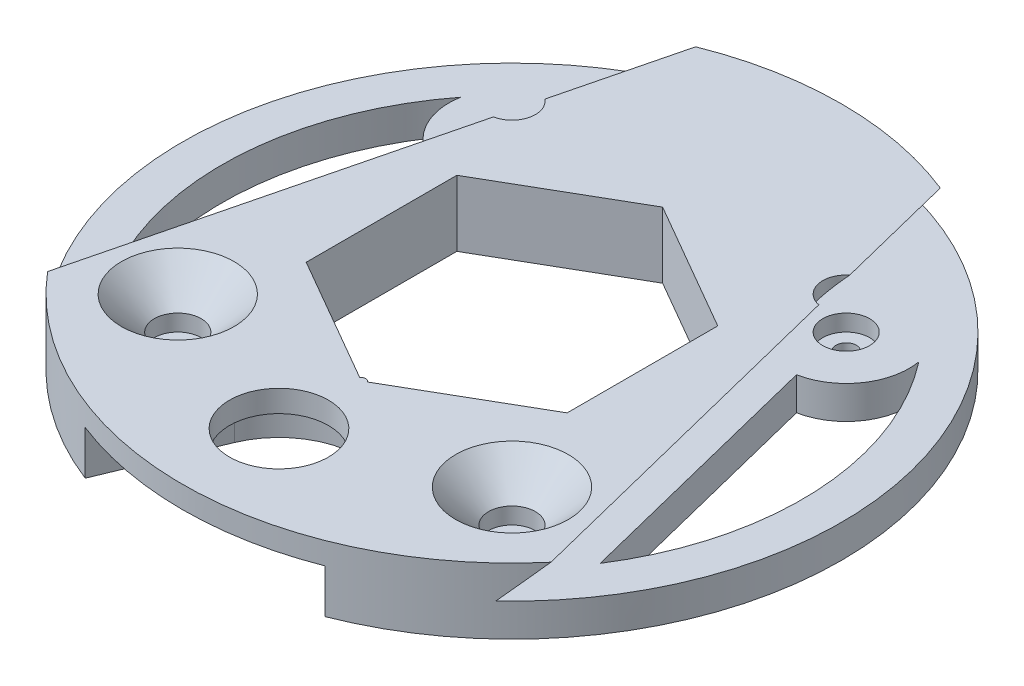
from build123d import *

# Parameters (mm, degrees)
SKETCH1_R               = 50
BOSS_EXTRUDE1_DEPTH     = 5
BOSS_EXTRUDE3_START     = 5
BOSS_EXTRUDE3_DEPTH     = 5
DRAFT2_ANGLE            = -45
CUT_EXTRUDE3_DEPTH      = 72.414284285
CUT_EXTRUDE3_DEPTH_BACK = 72.414284285
SKETCH3_R               = 7.5
CUT_EXTRUDE5_START      = -6.666666667
CUT_EXTRUDE5_DEPTH      = 6.666666667
SKETCH5_R               = 3.55
SKETCH5_R_2             = 1.55
CUT_EXTRUDE6_DEPTH      = 72.414284285
SKETCH5_3_R             = 3.55
SKETCH5_3_R_2           = 1.55
BOSS_EXTRUDE4_DEPTH     = 2.5
CUT_EXTRUDE8_DEPTH      = 72.414284285
CHAMFER1_SIZE           = 5
CUT_EXTRUDE9_DEPTH      = 71.887234394


with BuildPart() as part:
    # Sketch1 → Boss-Extrude1 (new body)
    with BuildSketch(Plane(origin=(0, 0, 0), x_dir=(1, 0, 0), z_dir=(0, 1, 0))):
        with Locations(Location((0, 0, 0), (0, 0, 270))):
            Circle(SKETCH1_R)
    extrude(amount=-BOSS_EXTRUDE1_DEPTH)

    # Sketch1<6> → Boss-Extrude3 (add)
    with BuildSketch(Plane(origin=(0, 0, 0), x_dir=(1, 0, 0), z_dir=(0, 1, 0)).offset(BOSS_EXTRUDE3_START)):
        with BuildLine():
            Line((-12.940952256, 48.296291314), (-34.10533906, -36.562629112))
            ThreePointArc((-34.10533906, -36.562629112), (0, -50), (34.10533906, -36.562629112))
            Line((34.10533906, -36.562629112), (12.940952256, 48.296291314))
            ThreePointArc((12.940952256, 48.296291314), (0, 50), (-12.940952256, 48.296291314))
        make_face()
    extrude(amount=-BOSS_EXTRUDE3_DEPTH)

    # Draft2
    draft2_faces = [part.faces().sort_by_distance(p)[0] for p in [
        (23.523145658, 2.5, -5.866831101),
        (-23.523145658, 2.5, -5.866831101),
    ]]
    draft(draft2_faces, Plane.ZX, DRAFT2_ANGLE)

    # Sketch3 → Cut-Extrude3 (cut, two sides: drawn at the far end of the back side and taken through both)
    with BuildSketch(Plane.XZ.offset(5).offset(-CUT_EXTRUDE3_DEPTH_BACK)):
        with Locations(Location((0, 35.355339059, 0), (0, 0, 270))):
            Circle(SKETCH3_R)
    extrude(amount=CUT_EXTRUDE3_DEPTH + CUT_EXTRUDE3_DEPTH_BACK, mode=Mode.SUBTRACT)

    # Sketch4 → Cut-Extrude5 (cut)
    with BuildSketch(Plane.XZ.offset(5).offset(CUT_EXTRUDE5_START)):
        with BuildLine():
            ThreePointArc((18.178606224, 46.578302628), (0, 50), (-18.178606224, 46.578302628))
            Line((-18.178606224, 46.578302628), (-11.548494202, 30.571796264))
            ThreePointArc((-11.548494202, 30.571796264), (3.3e-08, 22.855339059), (11.548494227, 30.571796326))
            Line((11.548494227, 30.571796326), (18.178606224, 46.578302628))
        make_face()
    extrude(amount=CUT_EXTRUDE5_DEPTH, mode=Mode.SUBTRACT)

    # Sketch5 → Cut-Extrude6 (cut, through all)
    # profile 1 of 8: a face of its own
    with BuildSketch(Plane.XZ.offset(5)):
        with Locations(Location((25.355339059, 25.355339059, 0), (0, 0, 270))):
            Circle(SKETCH5_R)
        with Locations((25.355339059, 25.355339059)):
            Circle(SKETCH5_R_2, mode=Mode.SUBTRACT)
    # profile 2 of 8: a face of its own
    with BuildSketch(Plane.XZ.offset(5)):
        with Locations((25.355339059, 25.355339059)):
            Circle(SKETCH5_R_2)
    # profile 3 of 8: a face of its own
    with BuildSketch(Plane.XZ.offset(5)):
        with Locations(Location((25.355339059, -25.355339059, 0), (0, 0, 270))):
            Circle(SKETCH5_R)
        with Locations((25.355339059, -25.355339059)):
            Circle(SKETCH5_R_2, mode=Mode.SUBTRACT)
    # profile 4 of 8: a face of its own
    with BuildSketch(Plane.XZ.offset(5)):
        with Locations((25.355339059, -25.355339059)):
            Circle(SKETCH5_R_2)
    # profile 5 of 8: a face of its own
    with BuildSketch(Plane.XZ.offset(5)):
        with Locations(Location((-25.355339059, -25.355339059, 0), (0, 0, 270))):
            Circle(SKETCH5_R)
        with Locations((-25.355339059, -25.355339059)):
            Circle(SKETCH5_R_2, mode=Mode.SUBTRACT)
    # profile 6 of 8: a face of its own
    with BuildSketch(Plane.XZ.offset(5)):
        with Locations((-25.355339059, -25.355339059)):
            Circle(SKETCH5_R_2)
    # profile 7 of 8: a face of its own
    with BuildSketch(Plane.XZ.offset(5)):
        with Locations(Location((-25.355339059, 25.355339059, 0), (0, 0, 270))):
            Circle(SKETCH5_R)
        with Locations((-25.355339059, 25.355339059)):
            Circle(SKETCH5_R_2, mode=Mode.SUBTRACT)
    # profile 8 of 8: a face of its own
    with BuildSketch(Plane.XZ.offset(5)):
        with Locations((-25.355339059, 25.355339059)):
            Circle(SKETCH5_R_2)
    extrude(amount=-CUT_EXTRUDE6_DEPTH, mode=Mode.SUBTRACT)

    # Sketch5<3> → Boss-Extrude4 (add)
    # profile 1 of 4: a face of its own
    with BuildSketch(Plane.XZ.offset(5)):
        with Locations(Location((25.355339059, -25.355339059, 0), (0, 0, 270))):
            Circle(SKETCH5_3_R)
        with Locations(Location((25.355339059, -25.355339059, 0), (0, 0, 270))):
            Circle(SKETCH5_3_R_2, mode=Mode.SUBTRACT)
    # profile 2 of 4: a face of its own
    with BuildSketch(Plane.XZ.offset(5)):
        with Locations(Location((-25.355339059, -25.355339059, 0), (0, 0, 270))):
            Circle(SKETCH5_3_R)
        with Locations(Location((-25.355339059, -25.355339059, 0), (0, 0, 270))):
            Circle(SKETCH5_3_R_2, mode=Mode.SUBTRACT)
    # profile 3 of 4: a face of its own
    with BuildSketch(Plane.XZ.offset(5)):
        with Locations(Location((25.355339059, 25.355339059, 0), (0, 0, 270))):
            Circle(SKETCH5_3_R)
        with Locations(Location((25.355339059, 25.355339059, 0), (0, 0, 270))):
            Circle(SKETCH5_3_R_2, mode=Mode.SUBTRACT)
    # profile 4 of 4: a face of its own
    with BuildSketch(Plane.XZ.offset(5)):
        with Locations(Location((-25.355339059, 25.355339059, 0), (0, 0, 270))):
            Circle(SKETCH5_3_R)
        with Locations(Location((-25.355339059, 25.355339059, 0), (0, 0, 270))):
            Circle(SKETCH5_3_R_2, mode=Mode.SUBTRACT)
    extrude(amount=-BOSS_EXTRUDE4_DEPTH)

    # Sketch6 → Cut-Extrude8 (cut, through all)
    with BuildSketch(Plane(origin=(0, 5, 0), x_dir=(1, 0, 0), z_dir=(0, 1, 0))):
        with BuildLine():
            ThreePointArc((-0.574925376, -22.523405739), (0, -22.191472419), (0.574925376, -22.523405739))
            Line((0.574925376, -22.523405739), (19.793304237, -11.42766953))
            Line((19.793304237, -11.42766953), (19.793304237, 11.42766953))
            Line((19.793304237, 11.42766953), (0, 22.855339059))
            Line((0, 22.855339059), (-19.793304237, 11.42766953))
            Line((-19.793304237, 11.42766953), (-19.793304237, -11.42766953))
            Line((-19.793304237, -11.42766953), (-0.574925376, -22.523405739))
        make_face()
    extrude(amount=-CUT_EXTRUDE8_DEPTH, mode=Mode.SUBTRACT)

    # Chamfer1
    chamfer1_edges = [part.edges().sort_by_distance(p)[0] for p in [
        (-25.355339059, 5, 28.905339059),
        (25.355339059, 5, 28.905339059),
    ]]
    chamfer(chamfer1_edges, length=CHAMFER1_SIZE)

    # Sketch7 → Cut-Extrude9 (cut, symmetric)
    with BuildSketch(Plane(origin=(0, 0, 0), x_dir=(1, 0, 0), z_dir=(0, 1, 0))):
        with BuildLine():
            ThreePointArc((-34.768601784, 26.965613845), (-43.954325541, 2.004311919), (-37.078464111, -23.689396344))
            Line((-37.078464111, -23.689396344), (-27.184130942, 15.982078141))
            ThreePointArc((-27.184130942, 15.982078141), (-33.213803419, 19.928826559), (-34.768601784, 26.965613845))
        make_face()
    cut_extrude9 = extrude(amount=CUT_EXTRUDE9_DEPTH, both=True, mode=Mode.SUBTRACT)

    # Mirror1: Cut-Extrude9 across plane
    add(cut_extrude9.mirror(Plane(origin=(0, 0, 0), x_dir=(0, 0, 1), z_dir=(1, 0, 0))), mode=Mode.SUBTRACT)


solid = part.part
